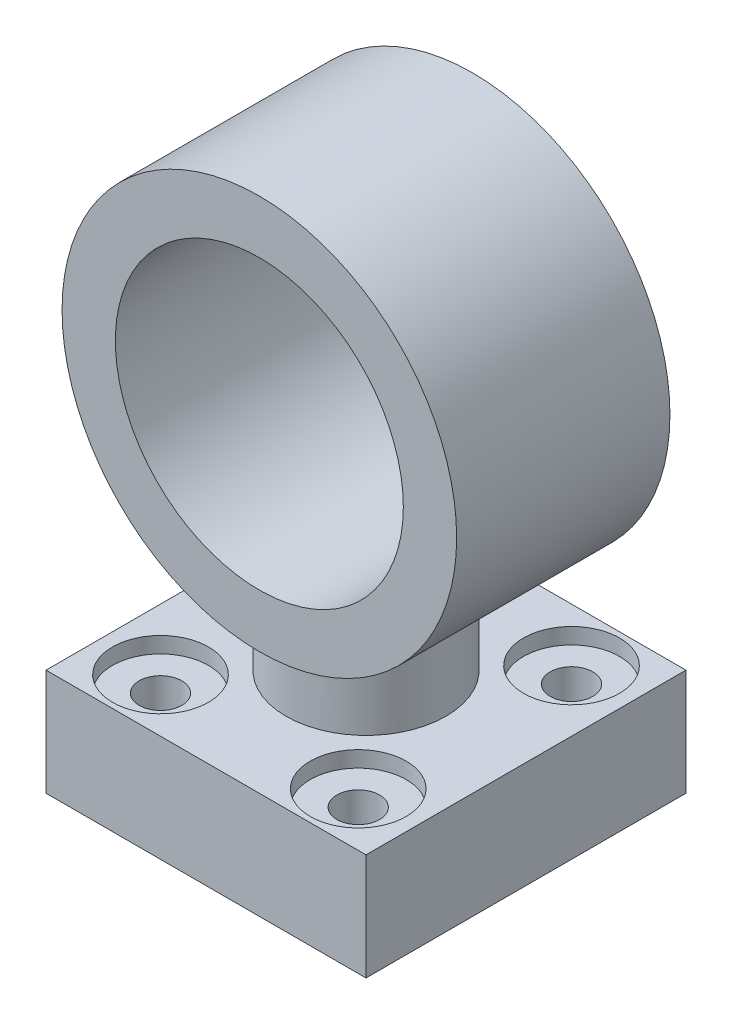
from build123d import *

# Parameters (mm, degrees)
SKETCH_1_R           = 18.5
SKETCH_1_R_2         = 13.5
EXTRUDE_1_DEPTH      = 10
EXTRUDE_2_REACH      = 50.317
EXTRUDE_2_END_RADIUS = 18.5
SKETCH_2_R           = 7.5
SKETCH_3_W           = 30
SKETCH_3_H           = 30
EXTRUDE_3_DEPTH      = 10
SKETCH_4_R           = 2
CUT_EXTRUDE_1_DEPTH  = 15
SKETCH_5_R           = 4.5
CUT_EXTRUDE_2_DEPTH  = 1.5


with BuildPart() as part:
    # 草图1 → 凸台-拉伸1 (new, symmetric)
    with BuildSketch(Plane.XY):
        Circle(SKETCH_1_R)
        Circle(SKETCH_1_R_2, mode=Mode.SUBTRACT)
    extrude(amount=EXTRUDE_1_DEPTH, both=True)

    # 凸台-拉伸2: up to this cylinder (the profile starts outside it)
    extrude_2_end = Plane(origin=(0, 0, 0), z_dir=(0, 0, -1)) * Cylinder(EXTRUDE_2_END_RADIUS, 138.634, mode=Mode.PRIVATE)
    # 草图2 → 凸台-拉伸2 (add, up to the surface)
    with BuildSketch(Plane(origin=(0, -25, 0), x_dir=(1, 0, 0), z_dir=(0, 1, 0)), mode=Mode.PRIVATE) as extrude_2_sk1:
        with Locations(Location((0, 0, 0), (0, 0, 90))):
            Circle(SKETCH_2_R)
    extrude_2_tool1 = extrude(extrude_2_sk1.sketch, amount=EXTRUDE_2_REACH, mode=Mode.PRIVATE) - extrude_2_end
    add(extrude_2_tool1.solids().sort_by_distance((0, -25, 0))[0])

    # 草图3 → 凸台-拉伸3 (add)
    with BuildSketch(Plane.XZ.offset(25)):
        Rectangle(SKETCH_3_W, SKETCH_3_H)
    extrude(amount=EXTRUDE_3_DEPTH)

    # 草图4 → 切除-拉伸1 (cut)
    with BuildSketch(Plane.XZ.offset(35)):
        with Locations(Location((-9.270440252, 10, 0), (0, 0, 270))):
            Circle(SKETCH_4_R)
        with Locations(Location((9.270440252, 10, 0), (0, 0, 270))):
            Circle(SKETCH_4_R)
        with Locations(Location((-9.270440252, -10, 0), (0, 0, 270))):
            Circle(SKETCH_4_R)
        with Locations(Location((9.270440252, -10, 0), (0, 0, 270))):
            Circle(SKETCH_4_R)
    extrude(amount=-CUT_EXTRUDE_1_DEPTH, mode=Mode.SUBTRACT)

    # 草图5 → 切除-拉伸2 (cut)
    with BuildSketch(Plane(origin=(0, -25, 0), x_dir=(1, 0, 0), z_dir=(0, 1, 0))):
        with Locations(Location((-9.270440252, -10, 0), (0, 0, 270))):
            Circle(SKETCH_5_R)
        with Locations(Location((9.270440252, -10, 0), (0, 0, 270))):
            Circle(SKETCH_5_R)
        with Locations(Location((9.270440252, 10, 0), (0, 0, 270))):
            Circle(SKETCH_5_R)
        with Locations(Location((-9.270440252, 10, 0), (0, 0, 270))):
            Circle(SKETCH_5_R)
    extrude(amount=-CUT_EXTRUDE_2_DEPTH, mode=Mode.SUBTRACT)


solid = part.part
